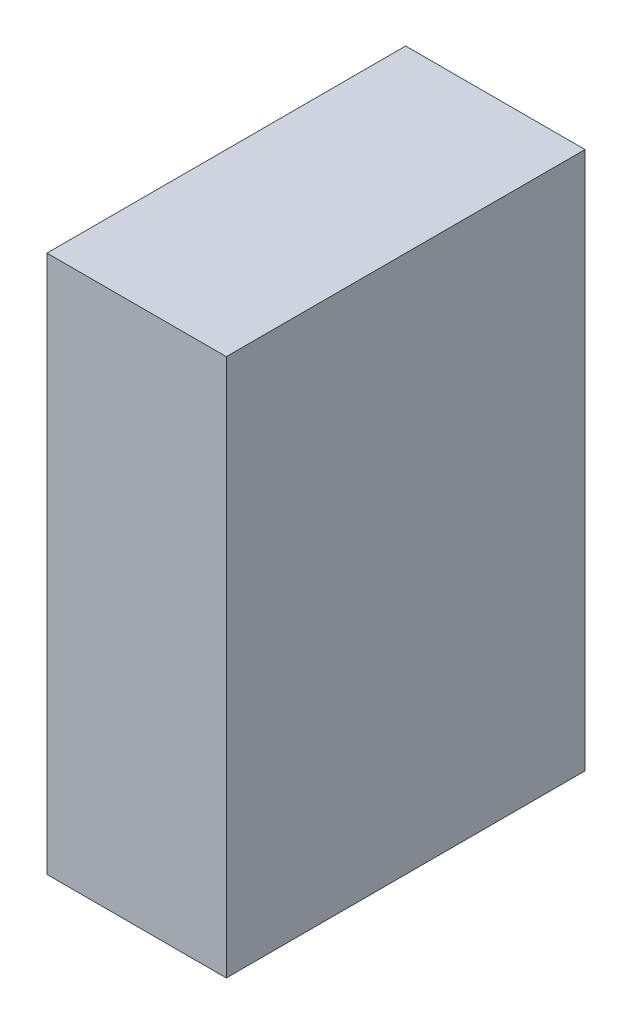
from build123d import *

# Parameters (mm, degrees)
SKETCH1_W           = 25
SKETCH1_H           = 75
BOSS_EXTRUDE1_DEPTH = 25


with BuildPart() as part:
    # Sketch1 → Boss-Extrude1 (new, symmetric)
    with BuildSketch(Plane.XY):
        Rectangle(SKETCH1_W, SKETCH1_H)
    extrude(amount=BOSS_EXTRUDE1_DEPTH, both=True)


solid = part.part
